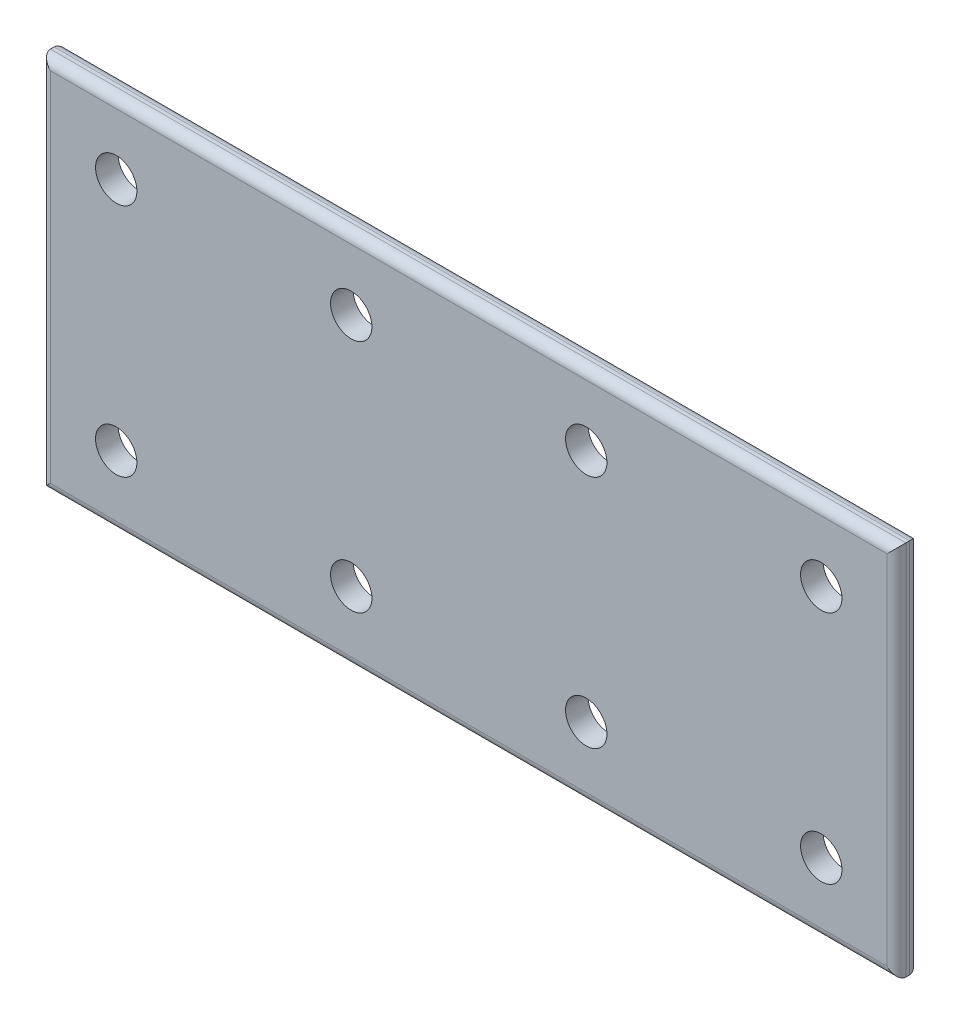
from build123d import *

# Parameters (mm, degrees)
SKETCH_1_W                  = 455
SKETCH_1_H                  = 200
EXTRUDE_1_DEPTH             = 12
SKETCH_2_R                  = 11
CUT_EXTRUDE_2_DEPTH         = 498.160939737
PATTERN_LINEAR_1_COUNT      = 4
PATTERN_LINEAR_1_PITCH      = 125
PATTERN_LINEAR_1_COUNT_DIR2 = 2
PATTERN_LINEAR_1_PITCH_DIR2 = 125
FILLET_1_R                  = 5
FILLET_2_R                  = 5


with BuildPart() as part:
    # 草图1 → 拉伸1 (new body)
    with BuildSketch(Plane.XY):
        with Locations((227.5, 100)):
            Rectangle(SKETCH_1_W, SKETCH_1_H)
    extrude(amount=EXTRUDE_1_DEPTH)

    # 草图2 → 拉伸2 (cut, through all)
    with BuildSketch(Plane.XY.offset(12)):
        with Locations((40, 37.5)):
            Circle(SKETCH_2_R)
    cut_extrude_2 = extrude(amount=-CUT_EXTRUDE_2_DEPTH, mode=Mode.SUBTRACT)

    # 阵列(线性)1: Cut-Extrude 2 4 × 2
    with Locations(*[(i * PATTERN_LINEAR_1_PITCH, j * PATTERN_LINEAR_1_PITCH_DIR2, 0) for i in range(PATTERN_LINEAR_1_COUNT) for j in range(PATTERN_LINEAR_1_COUNT_DIR2) if (i, j) != (0, 0)]):
        add(cut_extrude_2, mode=Mode.SUBTRACT)

    # 圆角1
    fillet_1_edges = [part.edges().sort_by_distance(p)[0] for p in [
        (455, 100, 12),
        (227.5, 200, 12),
        (0, 100, 12),
        (227.5, 0, 12),
    ]]
    fillet(fillet_1_edges, radius=FILLET_1_R)

    # 圆角2
    fillet_2_edges = [part.edges().sort_by_distance(p)[0] for p in [
        (227.5, 200, 0),
        (455, 100, 0),
        (227.5, 0, 0),
        (0, 100, 0),
    ]]
    fillet(fillet_2_edges, radius=FILLET_2_R)


solid = part.part
